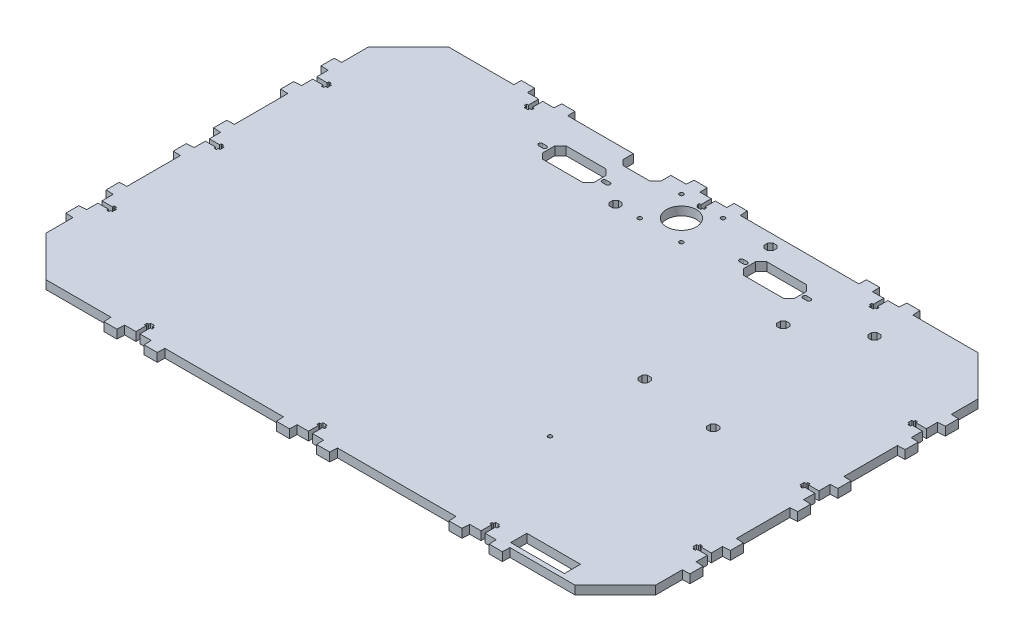
from build123d import *

# Parameters (mm, degrees)
SKETCH1_R           = 11.125
SKETCH1_R_2         = 1.5
SKETCH1_W           = 40
SKETCH1_H           = 12
BOSS_EXTRUDE1_DEPTH = 6.4


with BuildPart() as part:
    # Sketch1 → Boss-Extrude1 (new body)
    with BuildSketch(Plane(origin=(0, 0, 0), x_dir=(1, 0, 0), z_dir=(0, 1, 0))):
        Polygon((188.578883691, -149.100172173), (194.545097944, -149.100172173), (224.578883691, -119.066386426), (224.578883691, -99.223813), (230.078883691, -98.948813), (230.078883691, -89.248813), (224.578883691, -88.973813), (224.578883691, -80.600172173), (216.878883691, -80.600172173), (216.878883691, -81.848813), (215.078883691, -81.848813), (215.078883691, -80.600172173), (213.678883691, -80.600172173), (213.678883691, -77.598813), (215.078883691, -77.598813), (215.078883691, -76.348813), (216.878883691, -76.348813), (216.878883691, -77.598813), (224.578883691, -77.598813), (224.578883691, -69.223813), (230.078883691, -68.948813), (230.078883691, -59.248813), (224.578883691, -58.973813), (224.578883691, -19.123813), (230.078883691, -18.848813), (230.078883691, -9.148813), (224.578883691, -8.873813), (224.578883691, -0.500172173), (216.878883691, -0.500172173), (216.878883691, -1.748813), (215.078883691, -1.748813), (215.078883691, -0.500172173), (213.678883691, -0.500172173), (213.678883691, 2.501187), (215.078883691, 2.501187), (215.078883691, 3.751187), (216.878883691, 3.751187), (216.878883691, 2.501187), (224.578883691, 2.501187), (224.578883691, 10.876187), (230.078883691, 11.151187), (230.078883691, 20.851187), (224.578883691, 21.126187), (224.578883691, 60.976187), (230.078883691, 61.251187), (230.078883691, 70.951187), (224.578883691, 71.226187), (224.578883691, 79.599827827), (216.878883691, 79.599827827), (216.878883691, 78.351187), (215.078883691, 78.351187), (215.078883691, 79.599827827), (213.678883691, 79.599827827), (213.678883691, 82.601187), (215.078883691, 82.601187), (215.078883691, 83.851187), (216.878883691, 83.851187), (216.878883691, 82.601187), (224.518883691, 82.601187), (224.518883691, 90.976187), (230.018883691, 91.251187), (230.018883691, 100.951187), (224.518883691, 101.226187), (224.518883691, 121.067401253), (194.699899125, 150.886385819), (188.518883691, 150.867401253), (146.143883691, 150.901187), (145.868883691, 156.401187), (136.168883691, 156.401187), (135.893883691, 150.901187), (127.518883691, 150.901187), (127.518883691, 143.201187), (128.768883691, 143.201187), (128.768883691, 141.401187), (127.518883691, 141.401187), (127.518883691, 140.001187), (124.517524518, 140.001187), (124.517524518, 141.401187), (123.268883691, 141.401187), (123.268883691, 143.201187), (124.517524518, 143.201187), (124.517524518, 150.901187), (116.143883691, 150.901187), (115.868883691, 156.401187), (106.168883691, 156.401187), (105.893883691, 150.901187), (17.643204104, 150.901187), (17.368204104, 156.401187), (7.668204104, 156.401187), (7.393204104, 150.901187), (-0.980436722, 150.901187), (-0.980436722, 143.201187), (0.268204104, 143.201187), (0.268204104, 141.401187), (-0.980436722, 141.401187), (-0.980436722, 140.001187), (-3.981795896, 140.001187), (-3.981795896, 141.401187), (-5.231795896, 141.401187), (-5.231795896, 143.201187), (-3.981795896, 143.201187), (-3.981795896, 150.901187), (-12.356795896, 150.901187), (-12.631795896, 156.401187), (-22.331795896, 156.401187), (-22.606795896, 150.901187), (-34.05499857, 150.901187), (-34.05499857, 143.401187), (-38.05499857, 139.401187), (-58.05499857, 139.401187), (-62.05499857, 143.401187), (-62.05499857, 150.901187), (-110.856116309, 150.901187), (-111.131116309, 156.401187), (-120.831116309, 156.401187), (-121.106116309, 150.901187), (-129.479757136, 150.901187), (-129.479757136, 143.201187), (-128.231116309, 143.201187), (-128.231116309, 141.401187), (-129.479757136, 141.401187), (-129.479757136, 140.001187), (-132.481116309, 140.001187), (-132.481116309, 141.401187), (-133.731116309, 141.401187), (-133.731116309, 143.201187), (-132.481116309, 143.201187), (-132.481116309, 150.901187), (-140.856116309, 150.901187), (-141.131116309, 156.401187), (-150.831116309, 156.401187), (-151.106116309, 150.901187), (-199.647330562, 150.901187), (-229.481116309, 121.067401253), (-229.481116309, 101.226187), (-234.981116309, 100.951187), (-234.981116309, 91.251187), (-229.481116309, 90.976187), (-229.481116309, 82.601187), (-221.781116309, 82.601187), (-221.781116309, 83.851187), (-219.981116309, 83.851187), (-219.981116309, 82.601187), (-218.581116309, 82.601187), (-218.581116309, 79.599827827), (-219.981116309, 79.599827827), (-219.981116309, 78.351187), (-221.781116309, 78.351187), (-221.781116309, 79.599827827), (-229.481116309, 79.599827827), (-229.481116309, 71.226187), (-234.981116309, 70.951187), (-234.981116309, 61.251187), (-229.481116309, 60.976187), (-229.481116309, 21.226187), (-234.981116309, 20.951187), (-234.981116309, 11.251187), (-229.481116309, 10.976187), (-229.481116309, 2.601187), (-221.781116309, 2.601187), (-221.781116309, 3.851187), (-219.981116309, 3.851187), (-219.981116309, 2.601187), (-218.581116309, 2.601187), (-218.581116309, -0.400172173), (-219.981116309, -0.400172173), (-219.981116309, -1.648813), (-221.781116309, -1.648813), (-221.781116309, -0.400172173), (-229.481116309, -0.400172173), (-229.481116309, -8.773813), (-234.981116309, -9.048813), (-234.981116309, -18.748813), (-229.481116309, -19.023813), (-229.481116309, -58.773813), (-234.981116309, -59.048813), (-234.981116309, -68.748813), (-229.481116309, -69.023813), (-229.481116309, -77.398813), (-221.781116309, -77.398813), (-221.781116309, -76.148813), (-219.981116309, -76.148813), (-219.981116309, -77.398813), (-218.581116309, -77.398813), (-218.581116309, -80.400172173), (-219.981116309, -80.400172173), (-219.981116309, -81.648813), (-221.781116309, -81.648813), (-221.781116309, -80.400172173), (-229.481116309, -80.400172173), (-229.481116309, -88.773813), (-234.981116309, -89.048813), (-234.981116309, -98.748813), (-229.481116309, -99.023813), (-229.481116309, -119.066386427), (-199.447330562, -149.100172174), (-151.106116309, -149.100172174), (-150.831116309, -154.600172173), (-141.131116309, -154.600172173), (-140.856116309, -149.100172173), (-132.481116309, -149.100172173), (-132.481116309, -141.400172174), (-133.731116309, -141.400172174), (-133.731116309, -139.600172174), (-132.481116309, -139.600172174), (-132.481116309, -138.200172174), (-129.479757136, -138.200172174), (-129.479757136, -139.600172174), (-128.231116309, -139.600172174), (-128.231116309, -141.400172174), (-129.479757136, -141.400172174), (-129.479757136, -149.100172174), (-121.106116309, -149.100172174), (-120.831116309, -154.600172173), (-111.131116309, -154.600172173), (-110.856116309, -149.100172173), (-22.606795896, -149.100172173), (-22.331795896, -154.600172173), (-12.631795896, -154.600172173), (-12.356795896, -149.100172173), (-3.981795896, -149.100172173), (-3.981795896, -141.400172173), (-5.231795896, -141.400172173), (-5.231795896, -139.600172173), (-3.981795896, -139.600172173), (-3.981795896, -138.200172173), (-0.980436722, -138.200172173), (-0.980436722, -139.600172173), (0.268204104, -139.600172173), (0.268204104, -141.400172173), (-0.980436722, -141.400172173), (-0.980436722, -149.100172173), (7.393204104, -149.100172173), (7.668204104, -154.600172174), (17.368204104, -154.600172174), (17.643204104, -149.100172173), (105.893883691, -149.100172173), (106.168883691, -154.600172173), (115.868883691, -154.600172173), (116.143883691, -149.100172173), (124.517524518, -149.100172173), (124.517524518, -141.400172173), (123.268883691, -141.400172173), (123.268883691, -139.600172173), (124.517524518, -139.600172173), (124.517524518, -138.200172173), (127.518883691, -138.200172173), (127.518883691, -139.600172173), (128.768883691, -139.600172173), (128.768883691, -141.400172173), (127.518883691, -141.400172173), (127.518883691, -149.100172173), (135.893883691, -149.100172173), (136.168883691, -154.600172173), (145.868883691, -154.600172173), (146.143883691, -149.100172173), align=None)
        with Locations(Location((-2.481116309, 127.196931107, 0), (0, 0, 270))):
            Circle(SKETCH1_R, mode=Mode.SUBTRACT)
        with Locations(Location((89.228883691, -62.403614181, 0), (0, 0, 270))):
            Circle(SKETCH1_R_2, mode=Mode.SUBTRACT)
        with Locations(Location((-17.981116309, 142.701187, 0), (0, 0, 270))):
            Circle(SKETCH1_R_2, mode=Mode.SUBTRACT)
        with Locations(Location((13.018883691, 111.701187, 0), (0, 0, 270))):
            Circle(SKETCH1_R_2, mode=Mode.SUBTRACT)
        with Locations(Location((-17.981116309, 111.701187, 0), (0, 0, 270))):
            Circle(SKETCH1_R_2, mode=Mode.SUBTRACT)
        with Locations(Location((13.018883691, 142.701187, 0), (0, 0, 270))):
            Circle(SKETCH1_R_2, mode=Mode.SUBTRACT)
        Polygon((-96.306116309, 126.694586241), (-92.106116309, 130.894586241), (-62.356116309, 130.894586241), (-58.156116309, 126.694586241), (-58.156116309, 117.707787759), (-62.356116309, 113.507787759), (-92.106116309, 113.507787759), (-96.306116309, 117.707787759), align=None, mode=Mode.SUBTRACT)
        with BuildLine():
            Line((-52.106116309, 120.701187), (-55.106116309, 120.701187))
            ThreePointArc((-55.106116309, 120.701187), (-56.606116309, 122.201187), (-55.106116309, 123.701187))
            Line((-55.106116309, 123.701187), (-52.106116309, 123.701187))
            ThreePointArc((-52.106116309, 123.701187), (-50.606116309, 122.201187), (-52.106116309, 120.701187))
        make_face(mode=Mode.SUBTRACT)
        with BuildLine():
            Line((-102.356116309, 123.701187), (-99.356116309, 123.701187))
            ThreePointArc((-99.356116309, 123.701187), (-97.856116309, 122.201187), (-99.356116309, 120.701187))
            Line((-99.356116309, 120.701187), (-102.356116309, 120.701187))
            ThreePointArc((-102.356116309, 120.701187), (-103.856116309, 122.201187), (-102.356116309, 123.701187))
        make_face(mode=Mode.SUBTRACT)
        Polygon((146.011259569, 0.346350663), (148.032222779, 2.367313873), (148.032222779, 5.225387453), (146.011259569, 7.246350663), (143.153185989, 7.246350663), (141.132222779, 5.225387453), (141.132222779, 2.367313873), (143.153185989, 0.346350663), align=None, mode=Mode.SUBTRACT)
        with Locations((163.157593094, -139.600172173)):
            Rectangle(SKETCH1_W, SKETCH1_H, mode=Mode.SUBTRACT)
        Polygon((-34.62596178, 108.251187), (-32.60499857, 110.27215021), (-32.60499857, 113.13022379), (-34.62596178, 115.151187), (-37.48403536, 115.151187), (-39.50499857, 113.13022379), (-39.50499857, 110.27215021), (-37.48403536, 108.251187), align=None, mode=Mode.SUBTRACT)
        with BuildLine():
            Line((97.393883691, 120.701187), (94.393883691, 120.701187))
            ThreePointArc((94.393883691, 120.701187), (92.893883691, 122.201187), (94.393883691, 123.701187))
            Line((94.393883691, 123.701187), (97.393883691, 123.701187))
            ThreePointArc((97.393883691, 123.701187), (98.893883691, 122.201187), (97.393883691, 120.701187))
        make_face(mode=Mode.SUBTRACT)
        with BuildLine():
            Line((47.143883691, 123.701187), (50.143883691, 123.701187))
            ThreePointArc((50.143883691, 123.701187), (51.643883691, 122.201187), (50.143883691, 120.701187))
            Line((50.143883691, 120.701187), (47.143883691, 120.701187))
            ThreePointArc((47.143883691, 120.701187), (45.643883691, 122.201187), (47.143883691, 123.701187))
        make_face(mode=Mode.SUBTRACT)
        Polygon((91.343883691, 117.707787759), (91.343883691, 126.694586241), (87.143883691, 130.894586241), (57.393883691, 130.894586241), (53.193883691, 126.694586241), (53.193883691, 117.707787759), (57.393883691, 113.507787759), (87.143883691, 113.507787759), align=None, mode=Mode.SUBTRACT)
        Polygon((89.011259569, 6.346350663), (91.032222779, 8.367313873), (91.032222779, 11.225387453), (89.011259569, 13.246350663), (86.153185989, 13.246350663), (84.132222779, 11.225387453), (84.132222779, 8.367313873), (86.153185989, 6.346350663), align=None, mode=Mode.SUBTRACT)
        Polygon((50.596259569, 138.396350663), (52.617222779, 140.417313873), (52.617222779, 143.275387453), (50.596259569, 145.296350663), (47.738185989, 145.296350663), (45.717222779, 143.275387453), (45.717222779, 140.417313873), (47.738185989, 138.396350663), align=None, mode=Mode.SUBTRACT)
        Polygon((105.651259569, 92.846350663), (107.672222779, 94.867313873), (107.672222779, 97.725387453), (105.651259569, 99.746350663), (102.793185989, 99.746350663), (100.772222779, 97.725387453), (100.772222779, 94.867313873), (102.793185989, 92.846350663), align=None, mode=Mode.SUBTRACT)
        Polygon((147.011259569, 119.346350663), (149.032222779, 121.367313873), (149.032222779, 124.225387453), (147.011259569, 126.246350663), (144.153185989, 126.246350663), (142.132222779, 124.225387453), (142.132222779, 121.367313873), (144.153185989, 119.346350663), align=None, mode=Mode.SUBTRACT)
    extrude(amount=BOSS_EXTRUDE1_DEPTH)


solid = part.part
